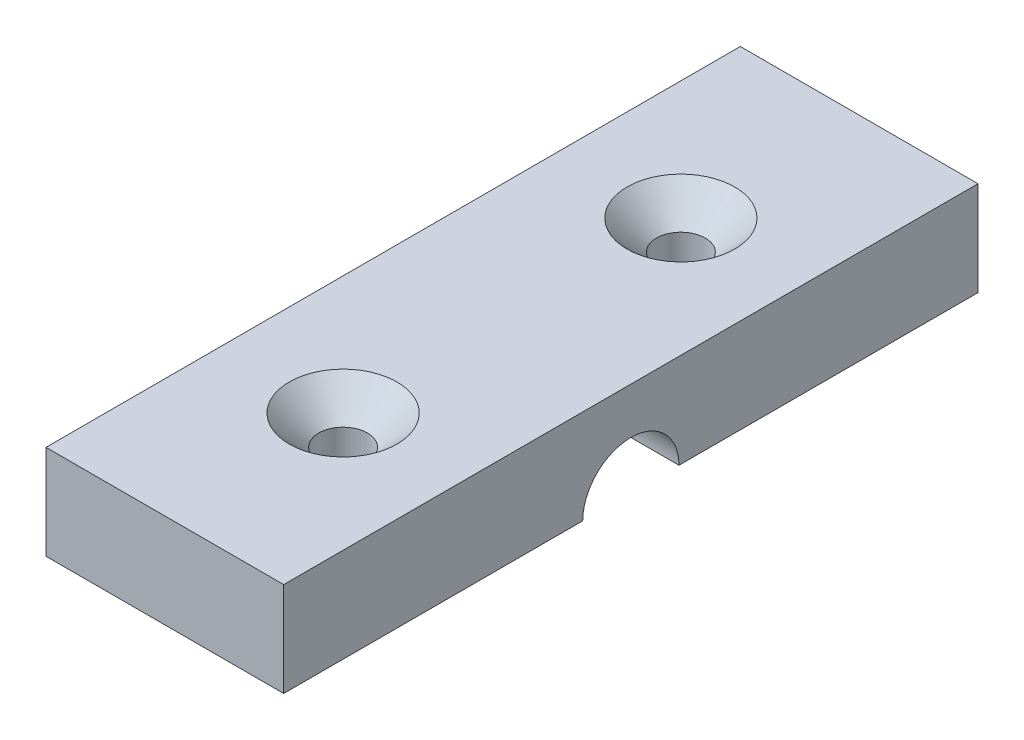
from build123d import *

# Parameters (mm, degrees)
SKETCH1_W           = 20
SKETCH1_H           = 58.42
SKETCH1_R           = 2.05
BOSS_EXTRUDE1_DEPTH = 7.9375
SKETCH2_R           = 4.05
CUT_EXTRUDE1_DEPTH  = 15
CHAMFER1_SIZE       = 2.48


with BuildPart() as part:
    # Sketch1 → Boss-Extrude1 (new body)
    with BuildSketch(Plane(origin=(0, -110.068674648, 0), x_dir=(1, 0, 0), z_dir=(0, 1, 0))):
        with Locations((78.333864278, -62.627324848)):
            Rectangle(SKETCH1_W, SKETCH1_H)
        with Locations(Location((78.333864278, -76.837324848, 0), (0, 0, 270))):
            Circle(SKETCH1_R, mode=Mode.SUBTRACT)
        with Locations(Location((78.333864278, -48.417324848, 0), (0, 0, 270))):
            Circle(SKETCH1_R, mode=Mode.SUBTRACT)
    extrude(amount=BOSS_EXTRUDE1_DEPTH)

    # Sketch2 → Cut-Extrude1 (cut)
    with BuildSketch(Plane(origin=(88.333864278, -1.5875, 4.936331956), x_dir=(0, 0, -1), z_dir=(1, 0, 0))):
        with Locations((-57.690992892, -108.481174648)):
            Circle(SKETCH2_R)
    extrude(amount=-CUT_EXTRUDE1_DEPTH, mode=Mode.SUBTRACT)

    # Chamfer1
    chamfer1_edges = [part.edges().sort_by_distance(p)[0] for p in [
        (78.333864278, -102.131174648, 74.787324848),
        (78.333864278, -102.131174648, 46.367324848),
    ]]
    chamfer(chamfer1_edges, length=CHAMFER1_SIZE)


solid = part.part
